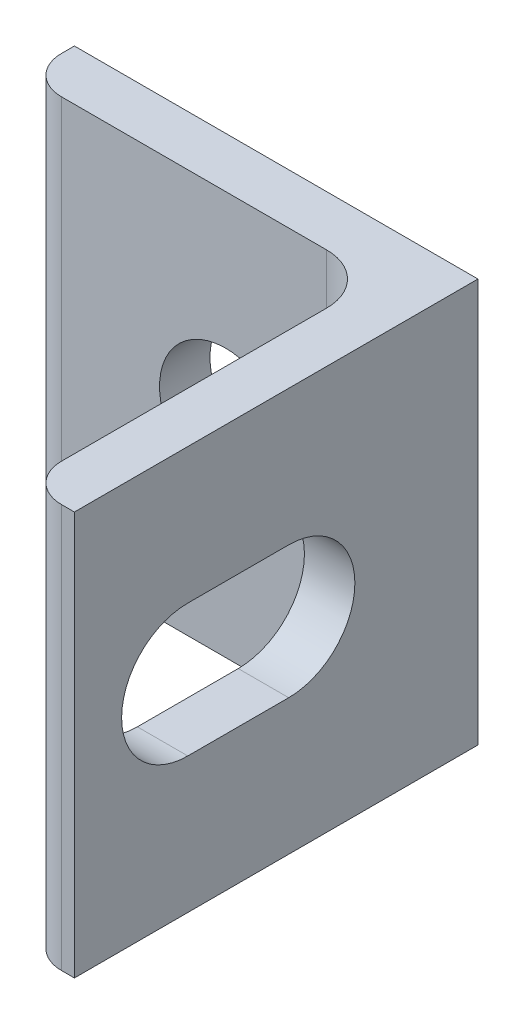
from build123d import *

# Parameters (mm, degrees)
SKETCH1_W           = 25.4
SKETCH1_H           = 25.4
BOSS_EXTRUDE1_DEPTH = 25.4
SKETCH2_W           = 22.225
SKETCH2_H           = 22.225
CUT_EXTRUDE1_DEPTH  = 44.994090512
CUT_EXTRUDE2_DEPTH  = 44.994090512
HOLE1_D             = 8.3312
FILLET1_R           = 2.3622
FILLET2_R           = 3.175


with BuildPart() as part:
    # Sketch1 → Boss-Extrude1 (new body)
    with BuildSketch(Plane(origin=(0, 0, 0), x_dir=(0, 0, -1), z_dir=(1, 0, 0))):
        with Locations((-12.7, -12.7)):
            Rectangle(SKETCH1_W, SKETCH1_H)
    extrude(amount=-BOSS_EXTRUDE1_DEPTH)

    # Sketch2 → Cut-Extrude1 (cut, through all)
    with BuildSketch(Plane.XZ.offset(25.4)):
        with Locations((-14.2875, 14.2875)):
            Rectangle(SKETCH2_W, SKETCH2_H)
    extrude(amount=-CUT_EXTRUDE1_DEPTH, mode=Mode.SUBTRACT)

    # Sketch3 → Cut-Extrude2 (cut, through all)
    with BuildSketch(Plane(origin=(0, 0, 0), x_dir=(0, 0, -1), z_dir=(1, 0, 0))):
        with BuildLine():
            Line((-18.2626, -16.8656), (-11.9126, -16.8656))
            ThreePointArc((-11.9126, -16.8656), (-7.747, -12.7), (-11.9126, -8.5344))
            Line((-11.9126, -8.5344), (-18.2626, -8.5344))
            ThreePointArc((-18.2626, -8.5344), (-22.4282, -12.7), (-18.2626, -16.8656))
        make_face()
    extrude(amount=-CUT_EXTRUDE2_DEPTH, mode=Mode.SUBTRACT)

    # Hole1 (through all)
    with Locations(Plane.XY.offset(3.175)):
        with Locations((-12.7, -12.7)):
            Hole(HOLE1_D / 2)

    # Fillet1
    fillet1_edges = [part.edges().sort_by_distance(p)[0] for p in [
        (-25.4, -12.7, 3.175),
        (-3.175, -12.7, 25.4),
    ]]
    fillet(fillet1_edges, radius=FILLET1_R)

    # Fillet2
    fillet2_edges = [part.edges().sort_by_distance(p)[0] for p in [
        (-3.175, -12.7, 3.175),
    ]]
    fillet(fillet2_edges, radius=FILLET2_R)


solid = part.part
